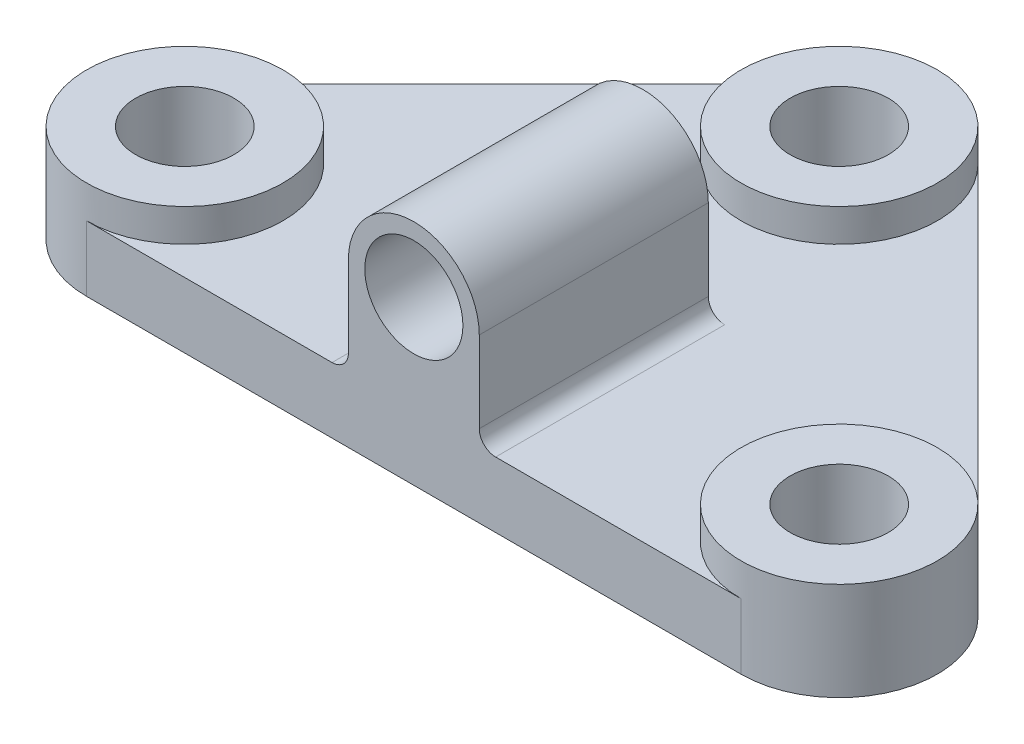
from build123d import *

# Parameters (mm, degrees)
BOSS_EXTRUDE2_DEPTH = 20
SKETCH3_R           = 30
SKETCH3_R_2         = 15
BOSS_EXTRUDE3_DEPTH = 30
SKETCH5_R           = 15
BOSS_EXTRUDE4_DEPTH = 70
FILLET1_R           = 5


with BuildPart() as part:
    # Sketch1 → Boss-Extrude2 (new body)
    with BuildSketch(Plane(origin=(0, 0, 0), x_dir=(1, 0, 0), z_dir=(0, 1, 0))):
        with BuildLine():
            Line((-121.213203436, 21.213203436), (-21.213203436, 121.213203436))
            ThreePointArc((-21.213203436, 121.213203436), (0, 70), (21.213203436, 121.213203436))
            Line((21.213203436, 121.213203436), (121.213203436, 21.213203436))
            ThreePointArc((121.213203436, 21.213203436), (72.283614025, 11.480502971), (100, -30))
            Line((100, -30), (-100, -30))
            ThreePointArc((-100, -30), (-72.283614025, 11.480502971), (-121.213203436, 21.213203436))
        make_face()
    extrude(amount=BOSS_EXTRUDE2_DEPTH)

    # Sketch3 → Boss-Extrude3 (add)
    # profile 1 of 3: a face of its own
    with BuildSketch(Plane.XZ):
        with Locations(Location((0, -100, 0), (0, 0, 270))):
            Circle(SKETCH3_R)
        with Locations(Location((0, -100, 0), (0, 0, 270))):
            Circle(SKETCH3_R_2, mode=Mode.SUBTRACT)
    # profile 2 of 3: a face of its own
    with BuildSketch(Plane.XZ):
        with Locations(Location((100, 0, 0), (0, 0, 270))):
            Circle(SKETCH3_R)
        with Locations(Location((100, 0, 0), (0, 0, 270))):
            Circle(SKETCH3_R_2, mode=Mode.SUBTRACT)
    # profile 3 of 3: a face of its own
    with BuildSketch(Plane.XZ):
        with Locations(Location((-100, 0, 0), (0, 0, 270))):
            Circle(SKETCH3_R)
        with Locations(Location((-100, 0, 0), (0, 0, 270))):
            Circle(SKETCH3_R_2, mode=Mode.SUBTRACT)
    extrude(amount=-BOSS_EXTRUDE3_DEPTH)

    # Sketch5 → Boss-Extrude4 (add)
    with BuildSketch(Plane.XY.offset(30)):
        with BuildLine():
            Line((-20, 49.8), (-20, 0))
            Line((-20, 0), (20, 0))
            Line((20, 0), (20, 49.8))
            ThreePointArc((20, 49.8), (0, 69.8), (-20, 49.8))
        make_face()
        with Locations((0, 49.8)):
            Circle(SKETCH5_R, mode=Mode.SUBTRACT)
    extrude(amount=-BOSS_EXTRUDE4_DEPTH)

    # Fillet1
    fillet1_edges = [part.edges().sort_by_distance(p)[0] for p in [
        (20, 20, -5),
        (-20, 20, -5),
    ]]
    fillet(fillet1_edges, radius=FILLET1_R)


solid = part.part
